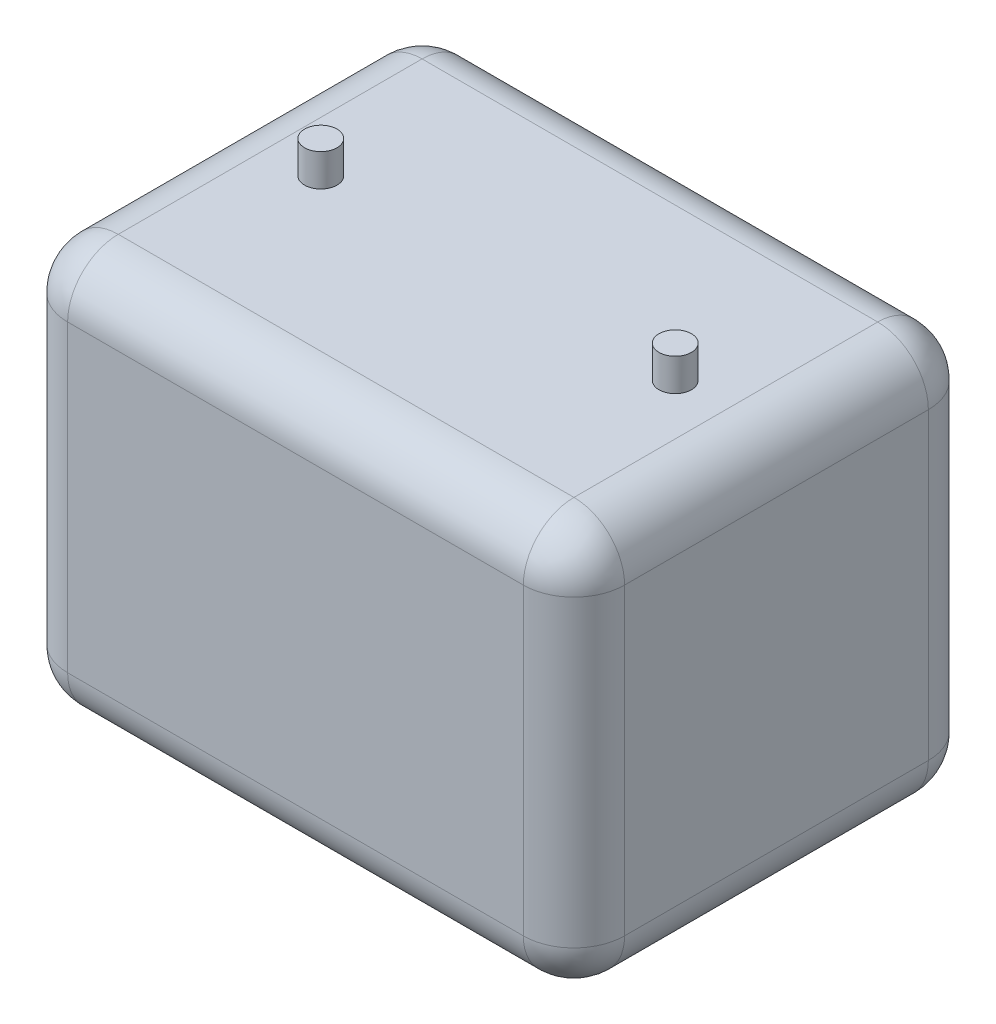
from build123d import *

# Parameters (mm, degrees)
SKETCH1_W           = 55
SKETCH1_H           = 40
BOSS_EXTRUDE1_DEPTH = 40
SKETCH2_R           = 1.6
BOSS_EXTRUDE2_DEPTH = 3.2
BOSS_EXTRUDE3_START = 3.2
SKETCH3_R           = 1.6
BOSS_EXTRUDE3_DEPTH = 3.2
FILLET2_R           = 5
FILLET3_R           = 5
FILLET4_R           = 5
FILLET5_R           = 5


with BuildPart() as part:
    # Sketch1 → Boss-Extrude1 (new body)
    with BuildSketch(Plane.XY):
        Rectangle(SKETCH1_W, SKETCH1_H)
    extrude(amount=BOSS_EXTRUDE1_DEPTH)

    # Sketch2 → Boss-Extrude2 (add)
    with BuildSketch(Plane(origin=(0, 20, 0), x_dir=(1, 0, 0), z_dir=(0, 1, 0))):
        with Locations(Location((-17.5, -20, 0), (0, 0, 90))):
            Circle(SKETCH2_R)
        with Locations(Location((17.5, -20, 0), (0, 0, 90))):
            Circle(SKETCH2_R)
    extrude(amount=BOSS_EXTRUDE2_DEPTH)

    # Sketch3 → Boss-Extrude3 (add)
    with BuildSketch(Plane.XZ.offset(20).offset(BOSS_EXTRUDE3_START)):
        with Locations(Location((-17.5, 20, 0), (0, 0, 270))):
            Circle(SKETCH3_R)
        with Locations(Location((17.5, 20, 0), (0, 0, 270))):
            Circle(SKETCH3_R)
    extrude(amount=-BOSS_EXTRUDE3_DEPTH)

    # Fillet2
    fillet2_edges = [part.edges().sort_by_distance(p)[0] for p in [
        (-27.5, -20, 20),
        (-27.5, 20, 20),
    ]]
    fillet(fillet2_edges, radius=FILLET2_R)

    # Fillet3
    fillet3_edges = [part.edges().sort_by_distance(p)[0] for p in [
        (27.5, -20, 20),
        (27.5, 20, 20),
    ]]
    fillet(fillet3_edges, radius=FILLET3_R)

    # Fillet4
    fillet4_edges = [part.edges().sort_by_distance(p)[0] for p in [
        (0, -20, 40),
        (-27.5, 0, 40),
        (-26.035533906, 18.535533906, 40),
        (-26.035533906, -18.535533906, 40),
        (27.5, 0, 40),
        (0, 20, 40),
        (26.035533906, 18.535533906, 40),
        (26.035533906, -18.535533906, 40),
    ]]
    fillet(fillet4_edges, radius=FILLET4_R)

    # Fillet5
    fillet5_edges = [part.edges().sort_by_distance(p)[0] for p in [
        (0, -20, 0),
        (-27.5, 0, 0),
        (-26.035533906, 18.535533906, 0),
        (-26.035533906, -18.535533906, 0),
        (27.5, 0, 0),
        (0, 20, 0),
        (26.035533906, 18.535533906, 0),
        (26.035533906, -18.535533906, 0),
    ]]
    fillet(fillet5_edges, radius=FILLET5_R)


solid = part.part
